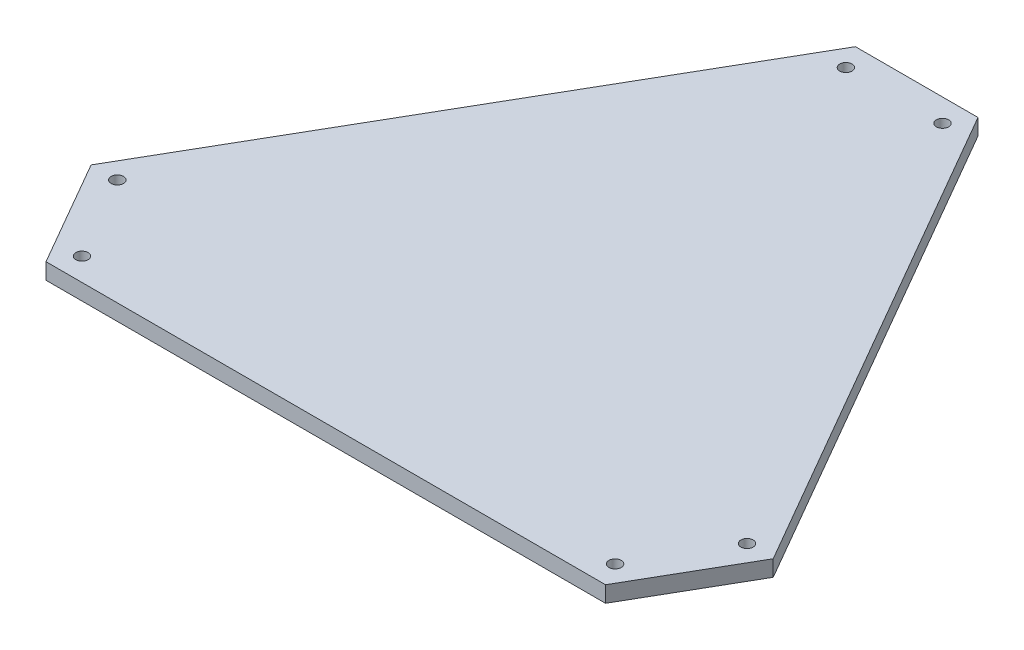
from build123d import *

# Parameters (mm, degrees)
RESSALTO_EXTRUS_O1_DEPTH = 3
CORTE_EXTRUS_O1_DEPTH    = 151.026697624
ESBO_O5_R                = 1.15
ESBO_O5_R_2              = 1.149998009
ESBO_O5_R_3              = 1.149993787
CORTE_EXTRUS_O3_DEPTH    = 128.178545465


with BuildPart() as part:
    # Esboço1 → Ressalto-extrusão1 (new body)
    with BuildSketch(Plane(origin=(0, 0, 0), x_dir=(1, 0, 0), z_dir=(0, 1, 0))):
        Polygon((-75, 0), (75, 0), (0, 129.9), align=None)
    extrude(amount=RESSALTO_EXTRUS_O1_DEPTH)

    # Esboço3 → Corte-extrusão1 (cut, through all)
    with BuildSketch(Plane(origin=(0, 3, 0), x_dir=(1, 0, 0), z_dir=(0, 1, 0))):
        Polygon((52.12820532, 0), (63.556663987, 19.819857975), (75, 0), align=None)
        Polygon((-52.141215794, 0), (-63.556663987, 19.819857975), (-75, 0), align=None)
        Polygon((-11.421585635, 110.117813679), (11.421585635, 110.117813679), (0, 129.9), align=None)
    extrude(amount=-CORTE_EXTRUS_O1_DEPTH, mode=Mode.SUBTRACT)

    # Esboço5 → Corte-extrusão3 (cut, through all)
    with BuildSketch(Plane(origin=(0, 3, 0), x_dir=(1, 0, 0), z_dir=(0, 1, 0))):
        with Locations(Location((-49.687989721, 4.250373636, 0), (0, 0, 270))):
            Circle(ESBO_O5_R)
        with Locations(Location((-58.687989721, 19.838830904, 0), (0, 0, 270))):
            Circle(ESBO_O5_R)
        with Locations(Location((58.661761519, 19.83730914, 0), (0, 0, 270))):
            Circle(ESBO_O5_R)
        with Locations(Location((49.661761519, 4.248851872, 0), (0, 0, 270))):
            Circle(ESBO_O5_R)
        with Locations(Location((-8.943534892, 105.865797451, 0), (0, 0, 270))):
            Circle(ESBO_O5_R_2)
        with Locations(Location((9.05637457, 105.866807251, 0), (0, 0, 270))):
            Circle(ESBO_O5_R_3)
    extrude(amount=-CORTE_EXTRUS_O3_DEPTH, mode=Mode.SUBTRACT)


solid = part.part
